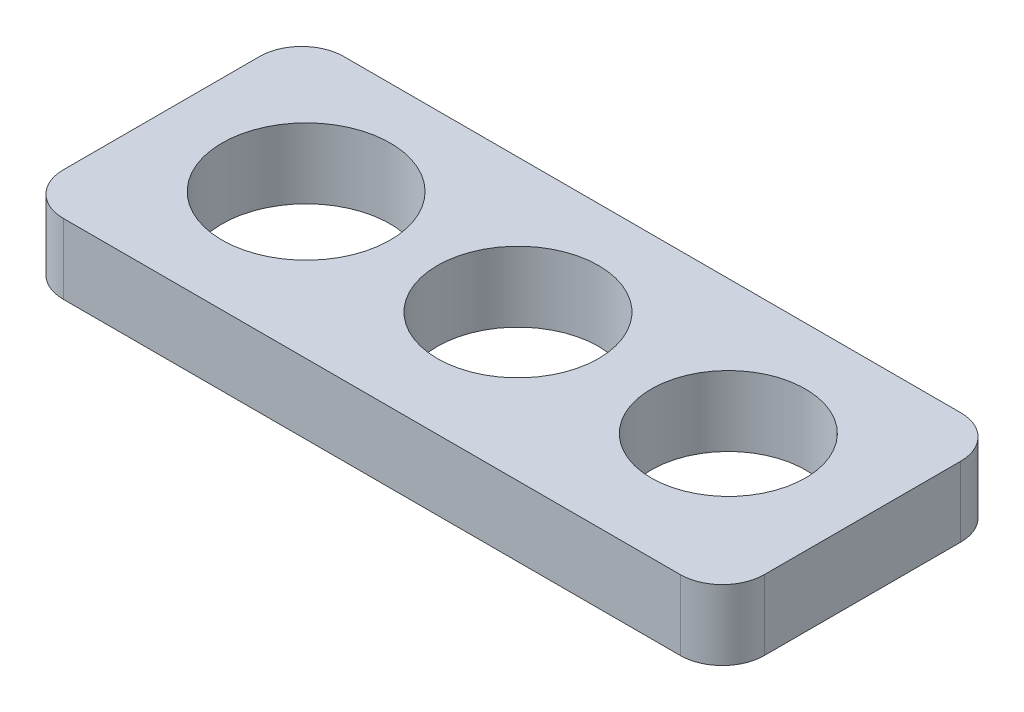
from build123d import *

# Parameters (mm, degrees)
BOSS_EXTRUDE1_DEPTH = 5
SKETCH3_R           = 6
SKETCH3_R_2         = 5.75
SKETCH3_R_3         = 5.5
CUT_EXTRUDE3_DEPTH  = 5


with BuildPart() as part:
    # Sketch1 → Boss-Extrude1 (new body)
    with BuildSketch(Plane(origin=(0, 0, 0), x_dir=(1, 0, 0), z_dir=(0, 1, 0))):
        with BuildLine():
            Line((3, 0), (47, 0))
            ThreePointArc((47, 0), (49.121320344, 0.878679656), (50, 3))
            Line((50, 3), (50, 17))
            ThreePointArc((50, 17), (49.121320344, 19.121320344), (47, 20))
            Line((47, 20), (3, 20))
            ThreePointArc((3, 20), (0.878679656, 19.121320344), (0, 17))
            Line((0, 17), (0, 3))
            ThreePointArc((0, 3), (0.878679656, 0.878679656), (3, 0))
        make_face()
    extrude(amount=BOSS_EXTRUDE1_DEPTH)

    # Sketch3 → Cut-Extrude3 (cut)
    with BuildSketch(Plane(origin=(0, 5, 0), x_dir=(1, 0, 0), z_dir=(0, 1, 0))):
        with Locations(Location((10, 10.316927666, 0), (0, 0, 270))):
            Circle(SKETCH3_R)
        with Locations(Location((24.996317756, 10.429067173, 0), (0, 0, 270))):
            Circle(SKETCH3_R_2)
        with Locations(Location((40, 10.429067173, 0), (0, 0, 270))):
            Circle(SKETCH3_R_3)
    extrude(amount=-CUT_EXTRUDE3_DEPTH, mode=Mode.SUBTRACT)


solid = part.part
